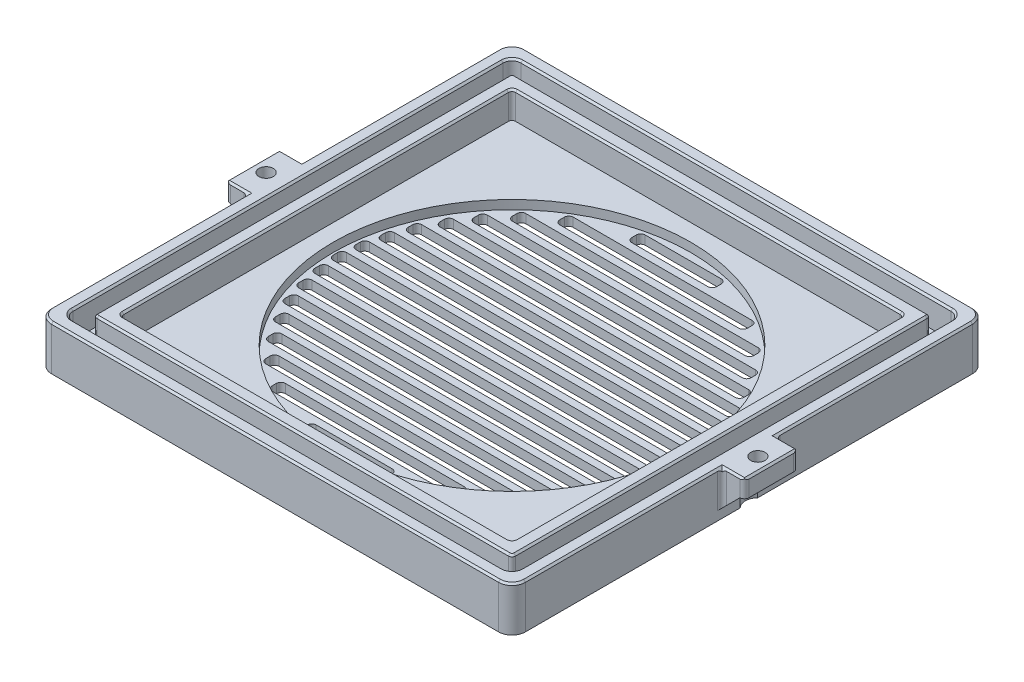
from build123d import *

# Parameters (mm, degrees)
SKETCH_1_W               = 106
SKETCH_1_H               = 106
EXTRUDE_1_DEPTH          = 10
SKETCH_2_W               = 100.2
SKETCH_2_H               = 100.2
SKETCH_2_W_2             = 93.6
SKETCH_2_H_2             = 93.6
CUT_EXTRUDE_1_DEPTH      = 6
SKETCH_3_W               = 87.6
SKETCH_3_H               = 87.6
CUT_EXTRUDE_3_DEPTH      = 6
SKETCH_4_R               = 40
CUT_EXTRUDE_4_DEPTH      = 2
FILLET_1_R               = 2
FILLET_2_R               = 3
FILLET_3_R               = 0.8
SKETCH_6_W               = 5
SKETCH_6_H               = 12
EXTRUDE_3_DEPTH          = 4
CHAMFER_1_SIZE           = 0.4
CHAMFER_2_SIZE           = 4
CUT_EXTRUDE_6_DEPTH      = 154.600130208
CUT_EXTRUDE_6_DEPTH_BACK = 4
SKETCH_7_R               = 1.6
SKETCH_8_R               = 2.8
CUT_EXTRUDE_7_DEPTH      = 154.600130208
FILLET_4_R               = 1
SKETCH_9_W               = 79
SKETCH_9_H               = 3
SKETCH_9_W_2             = 78
SKETCH_9_W_3             = 76
SKETCH_9_W_4             = 73
SKETCH_9_W_5             = 68
SKETCH_9_W_6             = 62
SKETCH_9_W_7             = 54
SKETCH_9_W_8             = 42
SKETCH_9_W_9             = 19
CUT_EXTRUDE_8_DEPTH      = 10
FILLET_5_R               = 1


with BuildPart() as part:
    # 草图1 → 凸台-拉伸1 (new body)
    with BuildSketch(Plane(origin=(0, 0, 0), x_dir=(1, 0, 0), z_dir=(0, 1, 0))):
        with Locations((53, 53)):
            Rectangle(SKETCH_1_W, SKETCH_1_H)
    extrude(amount=EXTRUDE_1_DEPTH)

    # 草图2 → 切除-拉伸1 (cut)
    with BuildSketch(Plane(origin=(0, 10, 0), x_dir=(1, 0, 0), z_dir=(0, 1, 0))):
        with Locations((53, 53)):
            Rectangle(SKETCH_2_W, SKETCH_2_H)
        with Locations((53, 53)):
            Rectangle(SKETCH_2_W_2, SKETCH_2_H_2, mode=Mode.SUBTRACT)
    extrude(amount=-CUT_EXTRUDE_1_DEPTH, mode=Mode.SUBTRACT)

    # 草图3 → 切除-拉伸3 (cut)
    with BuildSketch(Plane(origin=(0, 10, 0), x_dir=(1, 0, 0), z_dir=(0, 1, 0))):
        with Locations((53, 53)):
            Rectangle(SKETCH_3_W, SKETCH_3_H)
    extrude(amount=-CUT_EXTRUDE_3_DEPTH, mode=Mode.SUBTRACT)

    # 草图4 → 切除-拉伸4 (cut)
    with BuildSketch(Plane(origin=(0, 4, 0), x_dir=(-1, 0, 0), z_dir=(0, -1, 0))):
        with Locations(Location((-53, 53, 0), (0, 0, 90))):
            Circle(SKETCH_4_R)
    extrude(amount=CUT_EXTRUDE_4_DEPTH, mode=Mode.SUBTRACT)

    # 圆角1
    fillet_1_edges = [part.edges().sort_by_distance(p)[0] for p in [
        (2.9, 7, -103.1),
        (103.1, 7, -103.1),
        (103.1, 7, -2.9),
        (2.9, 7, -2.9),
    ]]
    fillet(fillet_1_edges, radius=FILLET_1_R)

    # 圆角2
    fillet_2_edges = [part.edges().sort_by_distance(p)[0] for p in [
        (0, 5, -106),
        (106, 5, -106),
        (106, 5, 0),
        (0, 5, 0),
    ]]
    fillet(fillet_2_edges, radius=FILLET_2_R)

    # 圆角3
    fillet_3_edges = [part.edges().sort_by_distance(p)[0] for p in [
        (99.8, 7, -99.8),
        (99.8, 7, -6.2),
        (6.2, 7, -6.2),
        (6.2, 7, -99.8),
        (96.8, 7, -96.8),
        (96.8, 7, -9.2),
        (9.2, 7, -9.2),
        (9.2, 7, -96.8),
    ]]
    fillet(fillet_3_edges, radius=FILLET_3_R)

    # 草图6 → 凸台-拉伸3 (add)
    with BuildSketch(Plane(origin=(0, 10, 0), x_dir=(1, 0, 0), z_dir=(0, 1, 0))):
        with Locations((-2.5, 53)):
            Rectangle(SKETCH_6_W, SKETCH_6_H)
        with Locations((108.5, 53)):
            Rectangle(SKETCH_6_W, SKETCH_6_H)
    extrude(amount=-EXTRUDE_3_DEPTH)

    # 倒角1
    chamfer_1_edges = [part.edges().sort_by_distance(p)[0] for p in [
        (53, 10, -9.2),
        (9.2, 10, -53),
        (53, 10, -96.8),
        (96.8, 10, -53),
        (99.8, 10, -53),
        (53, 10, -99.8),
        (6.2, 10, -53),
        (53, 10, -6.2),
        (99.565685425, 10, -6.434314575),
        (6.434314575, 10, -6.434314575),
        (6.434314575, 10, -99.565685425),
        (99.565685425, 10, -99.565685425),
        (9.434314575, 10, -9.434314575),
        (9.434314575, 10, -96.565685425),
        (96.565685425, 10, -96.565685425),
        (96.565685425, 10, -9.434314575),
        (0, 10, -25),
        (-2.5, 10, -59),
        (-5, 10, -53),
        (-2.5, 10, -47),
        (106, 10, -81),
        (108.5, 10, -47),
        (111, 10, -53),
        (108.5, 10, -59),
        (53, 10, -103.1),
        (103.1, 10, -53),
        (2.9, 10, -53),
        (53, 10, -2.9),
        (102.514213562, 10, -102.514213562),
        (3.485786438, 10, -102.514213562),
        (3.485786438, 10, -3.485786438),
        (102.514213562, 10, -3.485786438),
        (53, 10, -106),
        (106, 10, -25),
        (0, 10, -81),
        (53, 10, 0),
        (105.121320344, 10, -0.878679656),
        (0.878679656, 10, -0.878679656),
        (0.878679656, 10, -105.121320344),
        (105.121320344, 10, -105.121320344),
    ]]
    chamfer(chamfer_1_edges, length=CHAMFER_1_SIZE)

    # 倒角2
    chamfer_2_edges = [part.edges().sort_by_distance(p)[0] for p in [
        (0, 6, -53),
        (106, 6, -53),
    ]]
    chamfer(chamfer_2_edges, length=CHAMFER_2_SIZE)

    # 草图7 → 切除-拉伸6 (cut, two sides: drawn at the far end of the back side and taken through both)
    with BuildSketch(Plane(origin=(0, 6, 0), x_dir=(-1, 0, 0), z_dir=(0, -1, 0)).offset(-CUT_EXTRUDE_6_DEPTH_BACK)):
        with Locations((2, 53)):
            Circle(SKETCH_7_R)
        with Locations(Location((-108, 53, 0), (0, 0, 180))):
            Circle(SKETCH_7_R)
    extrude(amount=CUT_EXTRUDE_6_DEPTH + CUT_EXTRUDE_6_DEPTH_BACK, mode=Mode.SUBTRACT)

    # 草图8 → 切除-拉伸7 (cut, through all)
    with BuildSketch(Plane(origin=(0, 6, 0), x_dir=(-1, 0, 0), z_dir=(0, -1, 0))):
        with Locations((2, 53)):
            Circle(SKETCH_8_R)
        with Locations((-108, 53)):
            Circle(SKETCH_8_R)
    extrude(amount=CUT_EXTRUDE_7_DEPTH, mode=Mode.SUBTRACT)

    # 圆角4
    fillet_4_edges = [part.edges().sort_by_distance(p)[0] for p in [
        (106, 5.8, -47),
        (106, 5.8, -59),
        (111, 7.8, -59),
        (111, 7.8, -47),
        (0, 5.8, -47),
        (0, 5.8, -59),
        (-5, 7.8, -47),
        (-5, 7.8, -59),
    ]]
    fillet(fillet_4_edges, radius=FILLET_4_R)

    # 草图9 → 切除-拉伸8 (cut)
    with BuildSketch(Plane(origin=(0, 2, 0), x_dir=(1, 0, 0), z_dir=(0, 1, 0))):
        with Locations((53, 53)):
            Rectangle(SKETCH_9_W, SKETCH_9_H)
        with Locations((53, 57.6)):
            Rectangle(SKETCH_9_W_2, SKETCH_9_H)
        with Locations((53, 62.2)):
            Rectangle(SKETCH_9_W_3, SKETCH_9_H)
        with Locations((53, 66.8)):
            Rectangle(SKETCH_9_W_4, SKETCH_9_H)
        with Locations((53, 71.4)):
            Rectangle(SKETCH_9_W_5, SKETCH_9_H)
        with Locations((53, 76)):
            Rectangle(SKETCH_9_W_6, SKETCH_9_H)
        with Locations((53, 80.6)):
            Rectangle(SKETCH_9_W_7, SKETCH_9_H)
        with Locations((53, 85.2)):
            Rectangle(SKETCH_9_W_8, SKETCH_9_H)
        with Locations((53, 89.8)):
            Rectangle(SKETCH_9_W_9, SKETCH_9_H)
        with Locations((53, 16.2)):
            Rectangle(SKETCH_9_W_9, SKETCH_9_H)
        with Locations((53, 20.8)):
            Rectangle(SKETCH_9_W_8, SKETCH_9_H)
        with Locations((53, 25.4)):
            Rectangle(SKETCH_9_W_7, SKETCH_9_H)
        with Locations((53, 30)):
            Rectangle(SKETCH_9_W_6, SKETCH_9_H)
        with Locations((53, 34.6)):
            Rectangle(SKETCH_9_W_5, SKETCH_9_H)
        with Locations((53, 39.2)):
            Rectangle(SKETCH_9_W_4, SKETCH_9_H)
        with Locations((53, 43.8)):
            Rectangle(SKETCH_9_W_3, SKETCH_9_H)
        with Locations((53, 48.4)):
            Rectangle(SKETCH_9_W_2, SKETCH_9_H)
    extrude(amount=-CUT_EXTRUDE_8_DEPTH, mode=Mode.SUBTRACT)

    # 圆角5
    fillet_5_edges = [part.edges().sort_by_distance(p)[0] for p in [
        (14, 1, -46.9),
        (14, 1, -49.9),
        (92, 1, -49.9),
        (92, 1, -46.9),
        (15, 1, -42.3),
        (15, 1, -45.3),
        (91, 1, -45.3),
        (91, 1, -42.3),
        (16.5, 1, -37.7),
        (16.5, 1, -40.7),
        (89.5, 1, -40.7),
        (89.5, 1, -37.7),
        (19, 1, -33.1),
        (19, 1, -36.1),
        (87, 1, -36.1),
        (87, 1, -33.1),
        (22, 1, -28.5),
        (22, 1, -31.5),
        (84, 1, -31.5),
        (84, 1, -28.5),
        (26, 1, -23.9),
        (26, 1, -26.9),
        (80, 1, -26.9),
        (80, 1, -23.9),
        (32, 1, -19.3),
        (32, 1, -22.3),
        (74, 1, -22.3),
        (74, 1, -19.3),
        (43.5, 1, -14.7),
        (43.5, 1, -17.7),
        (62.5, 1, -17.7),
        (62.5, 1, -14.7),
        (43.5, 1, -88.3),
        (43.5, 1, -91.3),
        (62.5, 1, -91.3),
        (62.5, 1, -88.3),
        (32, 1, -83.7),
        (32, 1, -86.7),
        (74, 1, -86.7),
        (74, 1, -83.7),
        (26, 1, -79.1),
        (26, 1, -82.1),
        (80, 1, -82.1),
        (80, 1, -79.1),
        (22, 1, -74.5),
        (22, 1, -77.5),
        (84, 1, -77.5),
        (84, 1, -74.5),
        (19, 1, -69.9),
        (19, 1, -72.9),
        (87, 1, -72.9),
        (87, 1, -69.9),
        (16.5, 1, -65.3),
        (16.5, 1, -68.3),
        (89.5, 1, -68.3),
        (89.5, 1, -65.3),
        (15, 1, -60.7),
        (15, 1, -63.7),
        (91, 1, -63.7),
        (91, 1, -60.7),
        (14, 1, -56.1),
        (14, 1, -59.1),
        (92, 1, -59.1),
        (92, 1, -56.1),
        (13.5, 1, -51.5),
        (13.5, 1, -54.5),
        (92.5, 1, -54.5),
        (92.5, 1, -51.5),
    ]]
    fillet(fillet_5_edges, radius=FILLET_5_R)


solid = part.part
